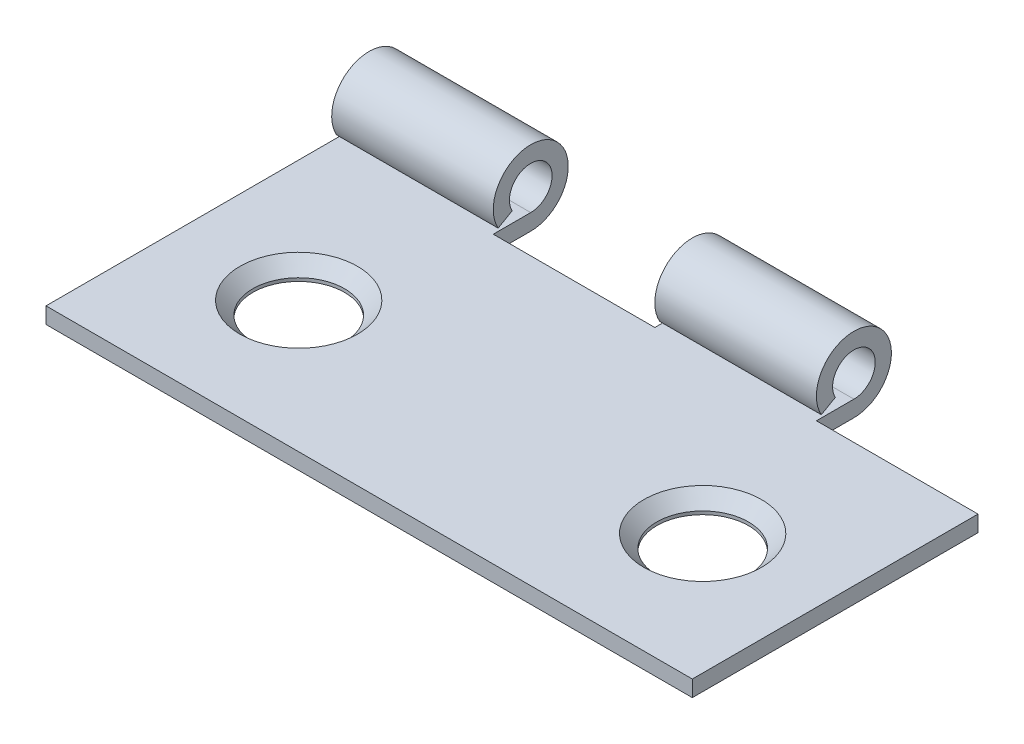
from build123d import *

# Parameters (mm, degrees)
BOSS_EXTRUDE1_DEPTH     = 12.7
SKETCH4_W               = 6.35
SKETCH4_H               = 2.9464
CUT_EXTRUDE1_DEPTH      = 19.020830121
LPATTERN1_COUNT         = 6
LPATTERN1_PITCH         = 12.7
CUT_EXTRUDE3_DEPTH      = 19.020830121
CUT_EXTRUDE3_DEPTH_BACK = 19.020830121
SKETCH9_R               = 1.8034


with BuildPart() as part:
    # Sketch3 → Boss-Extrude1 (new, symmetric)
    with BuildSketch(Plane(origin=(0, 0, 0), x_dir=(0, 0, -1), z_dir=(1, 0, 0))):
        with BuildLine():
            Line((0, -1.4732), (-12.7, -1.4732))
            Line((-12.7, -1.4732), (-12.7, -0.8382))
            Line((-12.7, -0.8382), (0, -0.8382))
            ThreePointArc((0, -0.8382), (0.421388638, 0.724576328), (-0.728533124, -0.414510226))
            Line((-0.728533124, -0.414510226), (-1.280452157, -0.728533124))
            ThreePointArc((-1.280452157, -0.728533124), (0.740622455, 1.273497789), (0, -1.4732))
        make_face()
    extrude(amount=BOSS_EXTRUDE1_DEPTH, both=True)

    # Sketch4 → Cut-Extrude1 (cut, symmetric)
    with BuildSketch(Plane(origin=(0, 0, 0), x_dir=(1, 0, 0), z_dir=(0, 1, 0))):
        with Locations((-3.175, 0)):
            Rectangle(SKETCH4_W, SKETCH4_H)
    cut_extrude1 = extrude(amount=CUT_EXTRUDE1_DEPTH, both=True, mode=Mode.SUBTRACT)

    # LPattern1: Cut-Extrude1 ×6
    with Locations(*[(i * LPATTERN1_PITCH, 0, 0) for i in range(1, LPATTERN1_COUNT)]):
        add(cut_extrude1, mode=Mode.SUBTRACT)

    # Cut-Extrude2 cone 1 section (through the dimple's axis) → Cut-Extrude2 (revolve, cut)
    with BuildSketch(Plane(origin=(7.9502, -0.8382, 7.5438), x_dir=(0, 0, 1), z_dir=(1, 0, 0))):
        Polygon((0, 0), (2.3114, 0), (0, 2.3114), align=None)
    revolve(axis=Axis((7.9502, -0.8382, 7.5438), (0, -1, 0)), mode=Mode.SUBTRACT)

    # Cut-Extrude2 cone 2 section (through the dimple's axis) → Cut-Extrude2 cone 2 (revolve, cut)
    with BuildSketch(Plane(origin=(-7.9248, -0.8382, 7.5438), x_dir=(0, 0, 1), z_dir=(1, 0, 0))):
        Polygon((0, 0), (2.3114, 0), (0, 2.3114), align=None)
    revolve(axis=Axis((-7.9248, -0.8382, 7.5438), (0, -1, 0)), mode=Mode.SUBTRACT)

    # Sketch9 → Cut-Extrude3 (cut, two sides: drawn at the far end of the back side and taken through both)
    with BuildSketch(Plane(origin=(0, 0, 0), x_dir=(1, 0, 0), z_dir=(0, 1, 0)).offset(-CUT_EXTRUDE3_DEPTH_BACK)):
        with Locations(Location((7.9502, -7.5438, 0), (0, 0, 270))):
            Circle(SKETCH9_R)
        with Locations(Location((-7.9248, -7.5438, 0), (0, 0, 270))):
            Circle(SKETCH9_R)
    extrude(amount=CUT_EXTRUDE3_DEPTH + CUT_EXTRUDE3_DEPTH_BACK, mode=Mode.SUBTRACT)


solid = part.part
